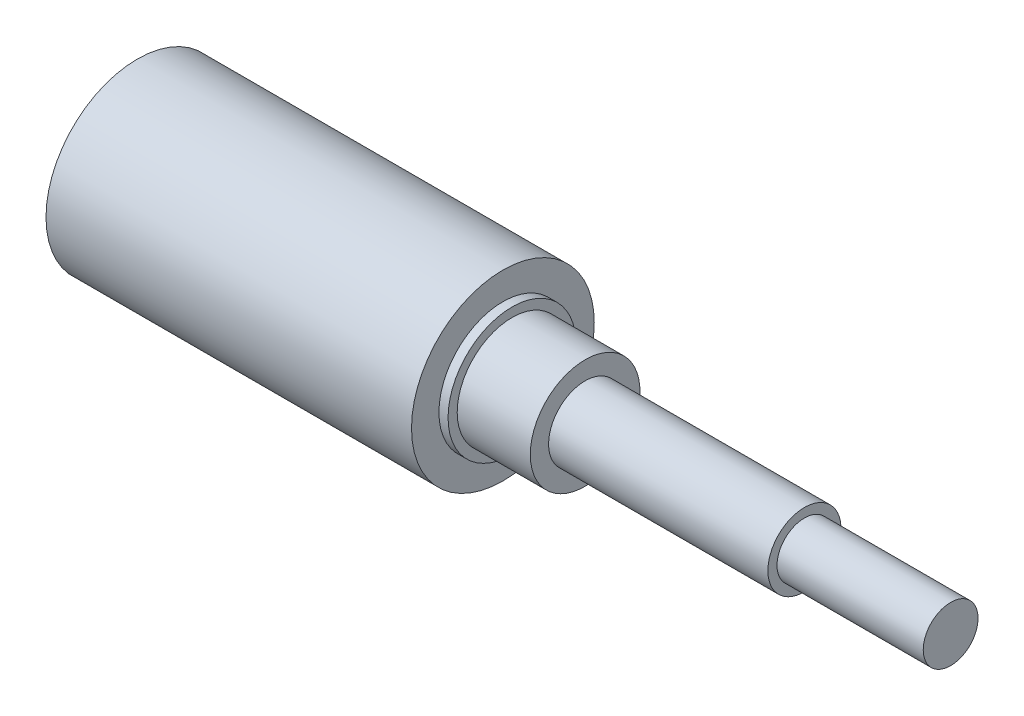
from build123d import *


with BuildPart() as part:
    # Sketch1 → Revolve1 (revolve)
    with BuildSketch(Plane.XY, mode=Mode.PRIVATE) as revolve1_sk:
        Polygon((0, 0), (44.5, 0), (44.5, 1.5), (36.5, 1.5), (36.5, 2), (24.5, 2), (24.5, 3), (20.5, 3), (20.5, 3.5), (20, 3.5), (20, 5), (0, 5), align=None)
    revolve(revolve1_sk.sketch.rotate(Axis((0, 0, 0), (1, 0, 0)), 90), axis=Axis((0, 0, 0), (1, 0, 0)))


solid = part.part
